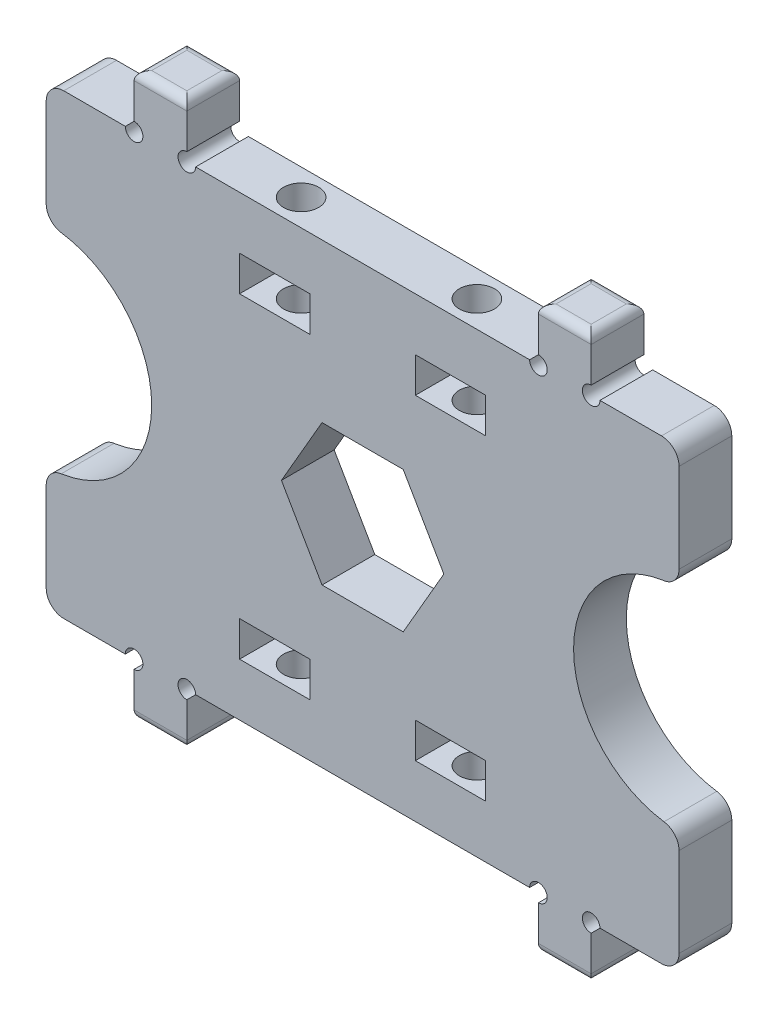
from build123d import *

# Parameters (mm, degrees)
SKETCH1_W           = 4
SKETCH1_H           = 2
BOSS_EXTRUDE1_DEPTH = 3
SKETCH2_R           = 1
CUT_EXTRUDE1_DEPTH  = 8
FILLET1_R           = 1
FILLET2_R           = 0.5


with BuildPart() as part:
    # Sketch1 → Boss-Extrude1 (new body)
    with BuildSketch(Plane.XY):
        with BuildLine():
            ThreePointArc((12, 13), (13.757359313, 8.757359313), (18, 7))
            Line((18, 7), (18, 0))
            Line((18, 0), (13.5, 0))
            ThreePointArc((13.5, 0), (12.646446609, 0.353553391), (13, -0.5))
            Line((13, -0.5), (13, -3))
            Line((13, -3), (10, -3))
            Line((10, -3), (10, -0.5))
            ThreePointArc((10, -0.5), (10.353553391, 0.353553391), (9.5, 0))
            Line((9.5, 0), (0, 0))
            Line((0, 0), (0, 9))
            Line((0, 9), (2.309401077, 9))
            Line((2.309401077, 9), (4.618802154, 13))
            Line((4.618802154, 13), (12, 13))
        make_face()
        with Locations((5, 4)):
            Rectangle(SKETCH1_W, SKETCH1_H, mode=Mode.SUBTRACT)
    extrude(amount=BOSS_EXTRUDE1_DEPTH)

    # Sketch2 → Cut-Extrude1 (cut)
    with BuildSketch(Plane.XZ):
        with Locations(Location((5, 1.5, 0), (0, 0, 270))):
            Circle(SKETCH2_R)
    extrude(amount=-CUT_EXTRUDE1_DEPTH, mode=Mode.SUBTRACT)

    # Fillet1
    fillet1_edges = [part.edges().sort_by_distance(p)[0] for p in [
        (18, 7, 1.5),
        (18, 0, 1.5),
    ]]
    fillet(fillet1_edges, radius=FILLET1_R)

    # Fillet2
    fillet2_edges = [part.edges().sort_by_distance(p)[0] for p in [
        (11.5, -3, 0),
        (13, -3, 1.5),
        (10, -3, 1.5),
        (11.5, -3, 3),
    ]]
    fillet(fillet2_edges, radius=FILLET2_R)

    # Mirror1: part across plane


with BuildPart() as part_1:
    add(part.part)
    add(part.part.mirror(Plane(origin=(0, 0, 3), x_dir=(0, 0, 1), z_dir=(-1, 0, 0))))

    # Mirror2: part across plane


with BuildPart() as part_2:
    add(part_1.part)
    add(part_1.part.mirror(Plane(origin=(0, 13, 3), x_dir=(0, 0, 1), z_dir=(0, 1, 0))))


solid = part_2.part
